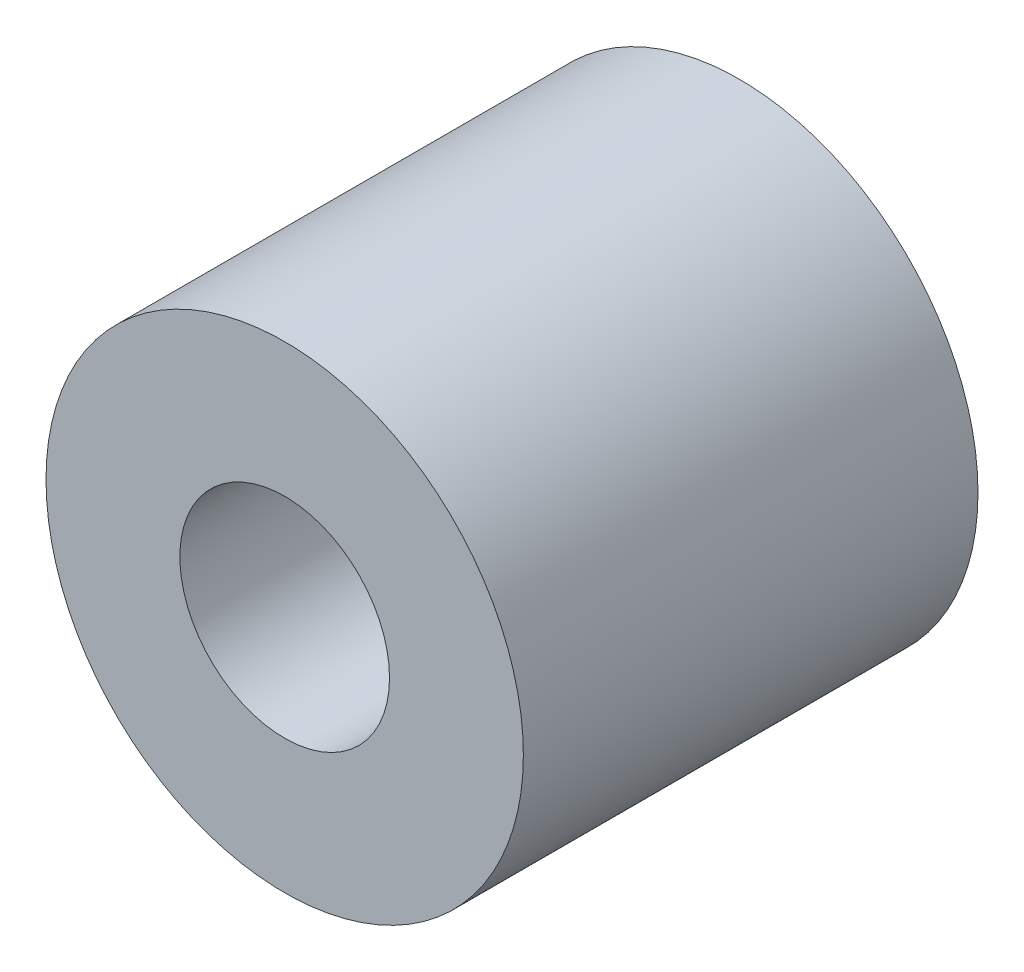
from build123d import *

# Parameters (mm, degrees)
SKETCH1_R           = 9.45
SKETCH1_R_2         = 4.15
BOSS_EXTRUDE1_DEPTH = 18


with BuildPart() as part:
    # Sketch1 → Boss-Extrude1 (new body)
    with BuildSketch(Plane.XY):
        Circle(SKETCH1_R)
        Circle(SKETCH1_R_2, mode=Mode.SUBTRACT)
    extrude(amount=BOSS_EXTRUDE1_DEPTH)


solid = part.part
